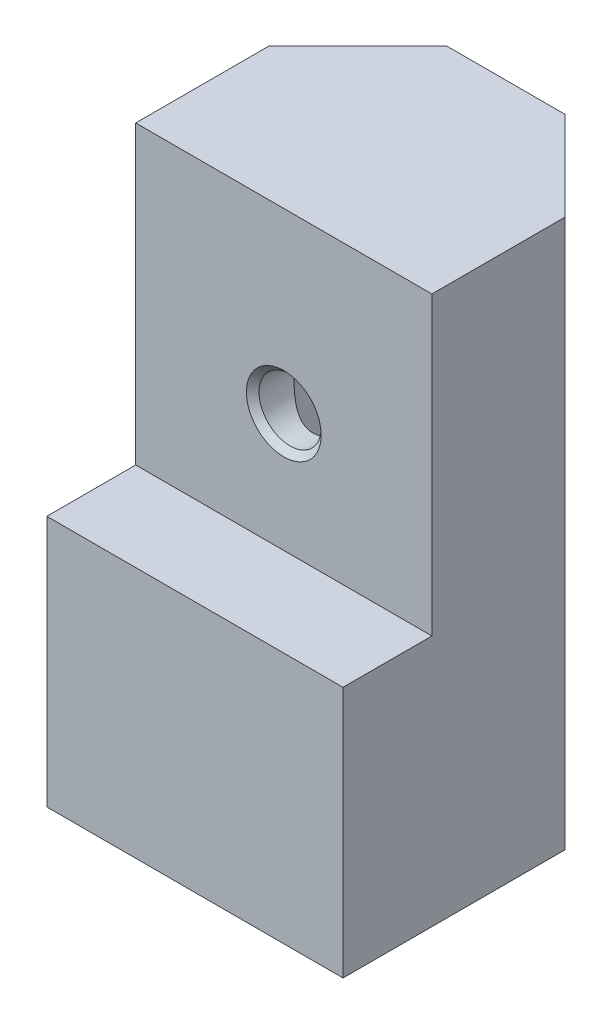
from build123d import *

# Parameters (mm, degrees)
SKETCH1_W                   = 20
SKETCH1_H                   = 17
BOSS_EXTRUDE1_DEPTH         = 6
SKETCH2_W                   = 20
SKETCH2_H                   = 37
BOSS_EXTRUDE2_DEPTH         = 15
M5_TAPPED_HOLE1_D           = 4.2
M5_TAPPED_HOLE1_DEPTH       = 9.8
M5_TAPPED_HOLE1_CSINK_D     = 5.05
M5_TAPPED_HOLE1_CSINK_ANGLE = 90
M5_TAPPED_HOLE1_TIP         = 1.2618073
SKETCH5_R                   = 3.05
CUT_EXTRUDE1_DEPTH          = 25
CHAMFER1_SIZE               = 6


with BuildPart() as part:
    # Sketch1 → Boss-Extrude1 (new body)
    with BuildSketch(Plane.XY):
        Rectangle(SKETCH1_W, SKETCH1_H)
    extrude(amount=BOSS_EXTRUDE1_DEPTH)

    # Sketch2 → Boss-Extrude2 (add)
    with BuildSketch(Plane(origin=(0, 0, 0), x_dir=(-1, 0, 0), z_dir=(0, 0, -1))):
        with Locations((0, 10)):
            Rectangle(SKETCH2_W, SKETCH2_H)
    extrude(amount=BOSS_EXTRUDE2_DEPTH)

    # M5 Tapped Hole1
    with Locations(Plane(origin=(0, 16.5, 0), x_dir=(1, 0, 0), z_dir=(0, 0, 1))):
        with Locations((0, 0)):
            CounterSinkHole(M5_TAPPED_HOLE1_D / 2, M5_TAPPED_HOLE1_CSINK_D / 2, depth=M5_TAPPED_HOLE1_DEPTH, counter_sink_angle=M5_TAPPED_HOLE1_CSINK_ANGLE)
            with Locations((0, 0, -(M5_TAPPED_HOLE1_DEPTH + M5_TAPPED_HOLE1_TIP / 2))):  # 118° drill point
                Cone(0, M5_TAPPED_HOLE1_D / 2, M5_TAPPED_HOLE1_TIP, mode=Mode.SUBTRACT)

    # Sketch5 → Cut-Extrude1 (cut)
    with BuildSketch(Plane.XZ.offset(8.5)):
        with Locations(Location((0, -5, 0), (0, 0, 270))):
            Circle(SKETCH5_R)
    extrude(amount=-CUT_EXTRUDE1_DEPTH, mode=Mode.SUBTRACT)

    # Chamfer1
    chamfer1_edges = [part.edges().sort_by_distance(p)[0] for p in [
        (10, 10, -15),
        (-10, 10, -15),
    ]]
    chamfer(chamfer1_edges, length=CHAMFER1_SIZE)


solid = part.part
